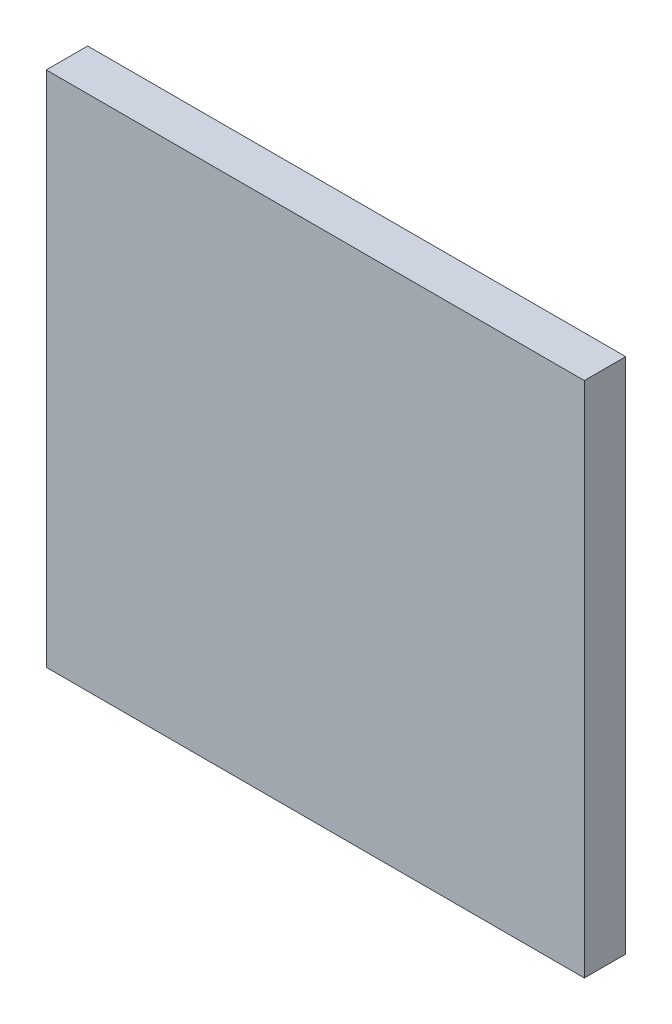
from build123d import *

# Parameters (mm, degrees)
CROQUIS1_W              = 52
CROQUIS1_H              = 50
SALIENTE_EXTRUIR1_DEPTH = 4


with BuildPart() as part:
    # Croquis1 → Saliente-Extruir1 (new body)
    with BuildSketch(Plane.XY):
        with Locations((26, -25)):
            Rectangle(CROQUIS1_W, CROQUIS1_H)
    extrude(amount=SALIENTE_EXTRUIR1_DEPTH)


solid = part.part
